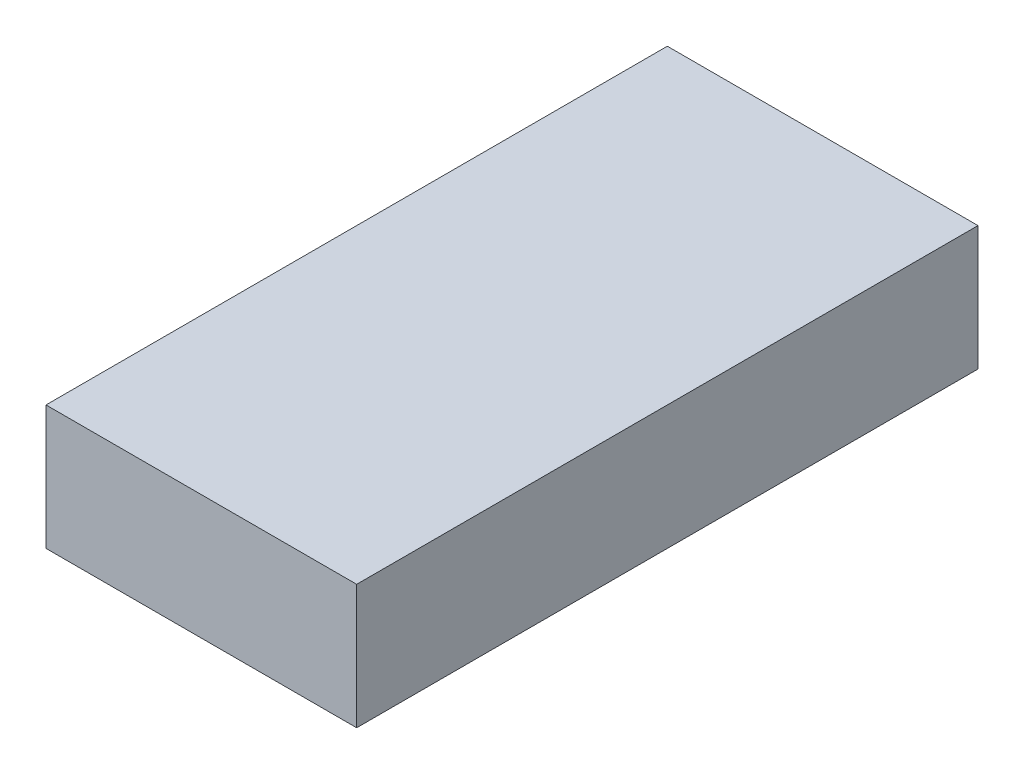
from build123d import *

# Parameters (mm, degrees)
SKETCH1_W           = 8
SKETCH1_H           = 3.2
BOSS_EXTRUDE1_DEPTH = 16
SKETCH2_W           = 4.8
SKETCH2_H           = 12.8
CUT_EXTRUDE1_DEPTH  = 1.8


with BuildPart() as part:
    # Sketch1 → Boss-Extrude1 (new body)
    with BuildSketch(Plane.XY):
        with Locations((4, 1.6)):
            Rectangle(SKETCH1_W, SKETCH1_H)
    extrude(amount=BOSS_EXTRUDE1_DEPTH)

    # Sketch2 → Cut-Extrude1 (cut)
    with BuildSketch(Plane.XZ):
        with Locations((4, 8)):
            Rectangle(SKETCH2_W, SKETCH2_H)
    extrude(amount=-CUT_EXTRUDE1_DEPTH, mode=Mode.SUBTRACT)


solid = part.part
